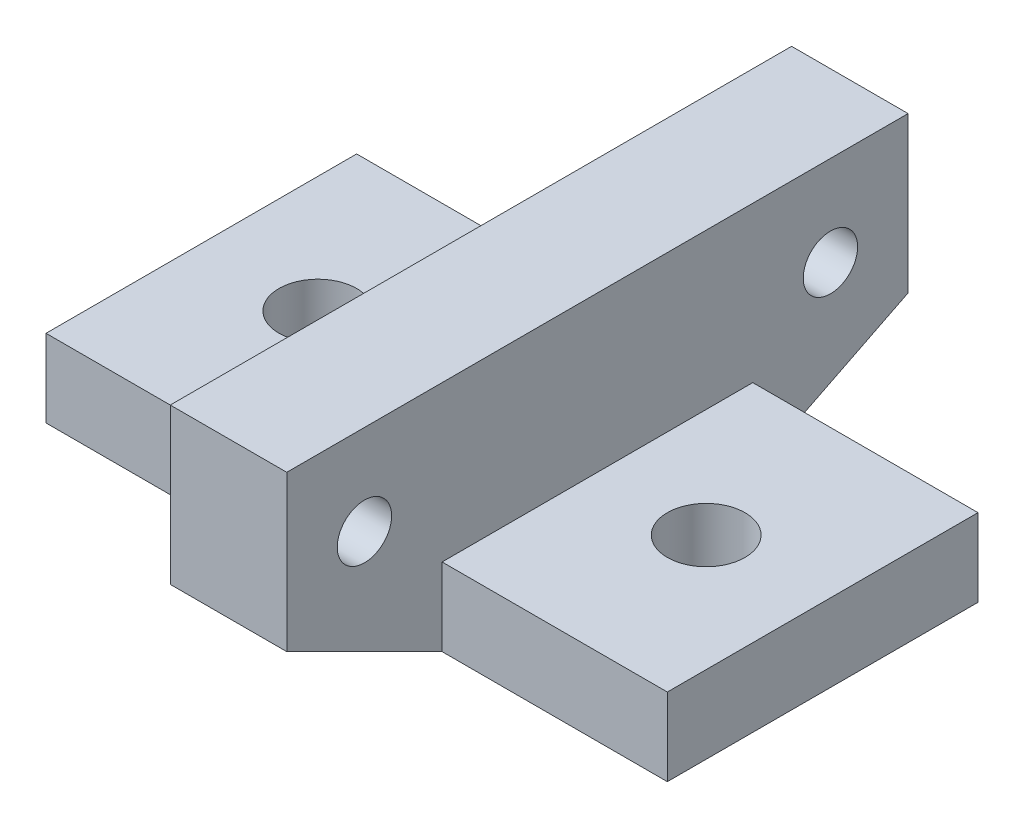
from build123d import *

# Parameters (mm, degrees)
SKETCH_1_W          = 40
SKETCH_1_H          = 20
SKETCH_1_R          = 2.5
EXTRUDE_1_DEPTH     = 5
SKETCH_2_W          = 7.5
SKETCH_2_H          = 40
EXTRUDE_2_DEPTH     = 10
SKETCH_3_R          = 1.75
CUT_EXTRUDE_1_DEPTH = 10
EXTRUDE_3_DEPTH     = 7.5


with BuildPart() as part:
    # 草图1 → 凸台-拉伸1 (new body)
    with BuildSketch(Plane(origin=(0, 0, 0), x_dir=(1, 0, 0), z_dir=(0, 1, 0))):
        Rectangle(SKETCH_1_W, SKETCH_1_H)
        with Locations(Location((-12.5, 0, 0), (0, 0, 270))):
            Circle(SKETCH_1_R, mode=Mode.SUBTRACT)
        with Locations(Location((12.5, 0, 0), (0, 0, 270))):
            Circle(SKETCH_1_R, mode=Mode.SUBTRACT)
    extrude(amount=EXTRUDE_1_DEPTH)

    # 草图2 → 凸台-拉伸2 (add)
    with BuildSketch(Plane(origin=(0, 5, 0), x_dir=(1, 0, 0), z_dir=(0, 1, 0))):
        with Locations((1.75, 0)):
            Rectangle(SKETCH_2_W, SKETCH_2_H)
    extrude(amount=EXTRUDE_2_DEPTH)

    # 草图3 → 切除-拉伸1 (cut)
    with BuildSketch(Plane(origin=(5.5, 0, 0), x_dir=(0, 0, -1), z_dir=(1, 0, 0))):
        with Locations((-15, 9.2)):
            Circle(SKETCH_3_R)
        with Locations((15, 9.2)):
            Circle(SKETCH_3_R)
    extrude(amount=-CUT_EXTRUDE_1_DEPTH, mode=Mode.SUBTRACT)

    # 草图4 → 凸台-拉伸3 (add)
    with BuildSketch(Plane(origin=(5.5, 0, 0), x_dir=(0, 0, -1), z_dir=(1, 0, 0))):
        Polygon((-20, 5), (-10, 0), (-10, 5), align=None)
        Polygon((10, 5), (10, 0), (20, 5), align=None)
    extrude(amount=-EXTRUDE_3_DEPTH)


solid = part.part
